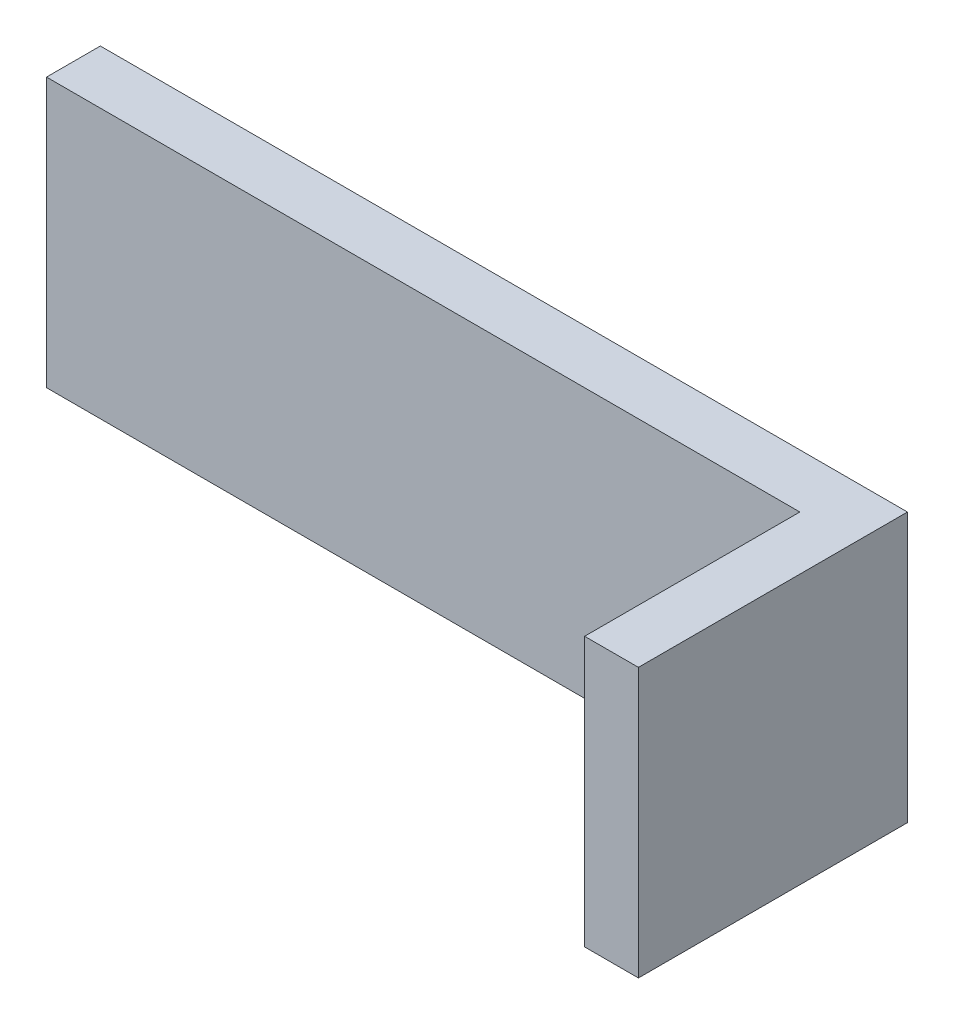
from build123d import *

# Parameters (mm, degrees)
SKETCH1_W           = 150
SKETCH1_H           = 50
BOSS_EXTRUDE1_DEPTH = 50
SKETCH2_W           = 140
SKETCH2_H           = 40
CUT_EXTRUDE1_DEPTH  = 50


with BuildPart() as part:
    # Sketch1 → Boss-Extrude1 (new body)
    with BuildSketch(Plane.XY):
        Rectangle(SKETCH1_W, SKETCH1_H)
    extrude(amount=BOSS_EXTRUDE1_DEPTH)

    # Sketch2 → Cut-Extrude1 (cut)
    with BuildSketch(Plane.XZ.offset(25)):
        with Locations((-5, 30)):
            Rectangle(SKETCH2_W, SKETCH2_H)
    extrude(amount=-CUT_EXTRUDE1_DEPTH, mode=Mode.SUBTRACT)


solid = part.part
